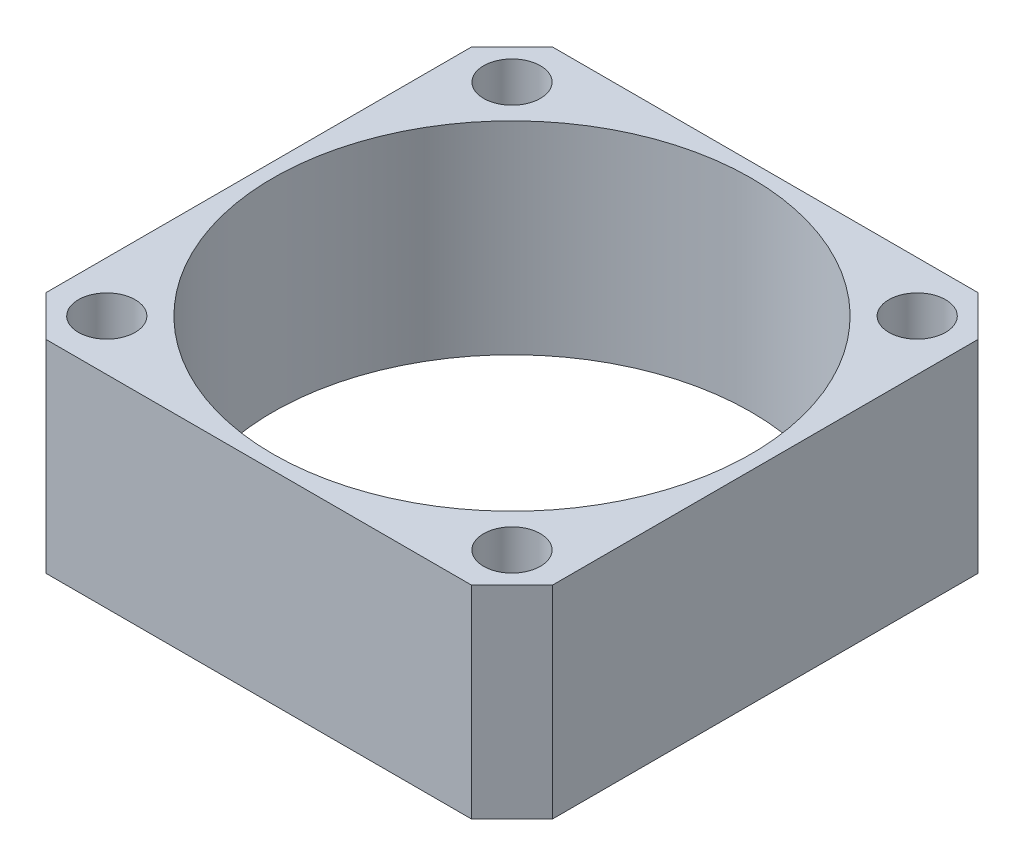
from build123d import *

# Parameters (mm, degrees)
SKETCH1_R           = 11.8
SKETCH1_R_2         = 1.4
BOSS_EXTRUDE2_DEPTH = 10


with BuildPart() as part:
    # Sketch1 → Boss-Extrude2 (new body)
    with BuildSketch(Plane(origin=(0, 0, 0), x_dir=(1, 0, 0), z_dir=(0, 1, 0))):
        Polygon((-12.5, 10.5), (-10.5, 12.5), (10.5, 12.5), (12.5, 10.5), (12.5, -10.5), (10.5, -12.5), (-10.5, -12.5), (-12.5, -10.5), align=None)
        with Locations(Location((0, 0, 0), (0, 0, 270))):
            Circle(SKETCH1_R, mode=Mode.SUBTRACT)
        with Locations(Location((-10, 10, 0), (0, 0, 270))):
            Circle(SKETCH1_R_2, mode=Mode.SUBTRACT)
        with Locations(Location((10, 10, 0), (0, 0, 270))):
            Circle(SKETCH1_R_2, mode=Mode.SUBTRACT)
        with Locations(Location((10, -10, 0), (0, 0, 270))):
            Circle(SKETCH1_R_2, mode=Mode.SUBTRACT)
        with Locations(Location((-10, -10, 0), (0, 0, 270))):
            Circle(SKETCH1_R_2, mode=Mode.SUBTRACT)
    extrude(amount=BOSS_EXTRUDE2_DEPTH)


solid = part.part
